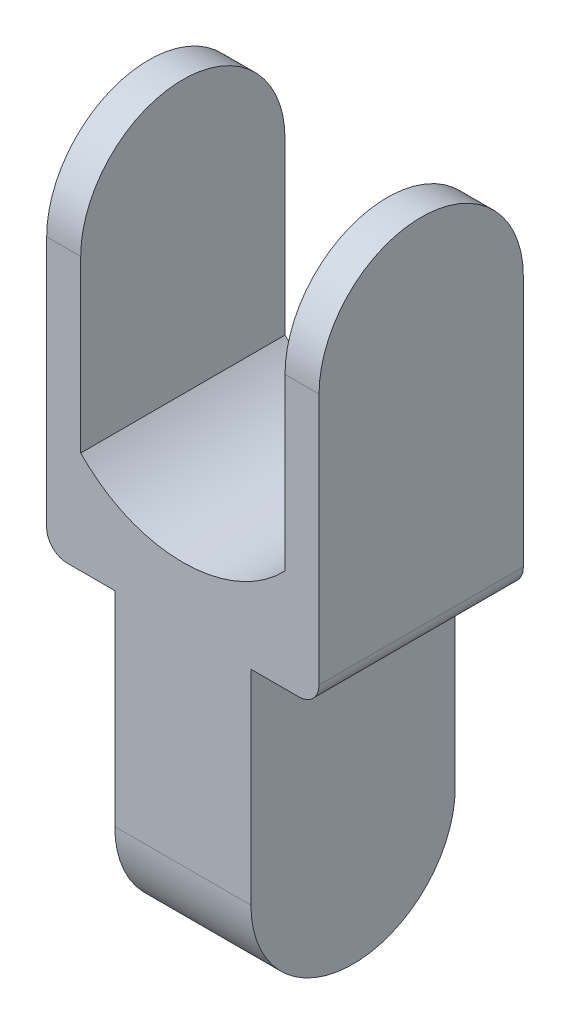
from build123d import *

# Parameters (mm, degrees)
SKETCH_1_R          = 150
EXTRUDE_1_DEPTH     = 100
SKETCH_2_W          = 200
SKETCH_2_H          = 300
EXTRUDE_2_DEPTH     = 300
EXTRUDE_4_DEPTH     = 150
SKETCH_6_R          = 150
EXTRUDE_5_DEPTH     = 200
SKETCH_7_W          = 300
SKETCH_7_H          = 800
CUT_EXTRUDE_1_DEPTH = 200
FILLET_1_R          = 30
FILLET_2_R          = 30
CUT_EXTRUDE_3_DEPTH = 213.5


with BuildPart() as part:
    # 草图1 → 凸台-拉伸1 (new, symmetric)
    with BuildSketch(Plane(origin=(0, 0, 0), x_dir=(0, 0, -1), z_dir=(1, 0, 0))):
        Circle(SKETCH_1_R)
    extrude(amount=EXTRUDE_1_DEPTH, both=True)

    # 草图2 → 凸台-拉伸2 (add)
    with BuildSketch(Plane(origin=(0, 0, 0), x_dir=(1, 0, 0), z_dir=(0, 1, 0))):
        Rectangle(SKETCH_2_W, SKETCH_2_H)
    extrude(amount=EXTRUDE_2_DEPTH)

    # 草图5 → 凸台-拉伸4 (add, symmetric)
    with BuildSketch(Plane.XY):
        Polygon((-200, 300), (-200, 700), (0, 700), (200, 700), (200, 300), (0, 300), align=None)
    extrude(amount=EXTRUDE_4_DEPTH, both=True)

    # 草图6 → 凸台-拉伸5 (add, symmetric)
    with BuildSketch(Plane(origin=(0, 0, 0), x_dir=(0, 0, -1), z_dir=(1, 0, 0))):
        with Locations((0, 700)):
            Circle(SKETCH_6_R)
    extrude(amount=EXTRUDE_5_DEPTH, both=True)

    # 草图7 → 切除-拉伸1 (cut, symmetric)
    with BuildSketch(Plane.XY):
        with Locations((0, 850)):
            Rectangle(SKETCH_7_W, SKETCH_7_H)
    extrude(amount=CUT_EXTRUDE_1_DEPTH, both=True, mode=Mode.SUBTRACT)

    # 圆角1
    fillet_1_edges = [part.edges().sort_by_distance(p)[0] for p in [
        (-200, 300, 0),
    ]]
    fillet(fillet_1_edges, radius=FILLET_1_R)

    # 圆角2
    fillet_2_edges = [part.edges().sort_by_distance(p)[0] for p in [
        (200, 300, 0),
    ]]
    fillet(fillet_2_edges, radius=FILLET_2_R)

    # 草图9 → 切除-拉伸3 (cut, symmetric)
    with BuildSketch(Plane.XY):
        with BuildLine():
            Line((-150, 450), (150, 450))
            ThreePointArc((150, 450), (0, 385.920784964), (-150, 450))
        make_face()
    extrude(amount=CUT_EXTRUDE_3_DEPTH, both=True, mode=Mode.SUBTRACT)


solid = part.part
